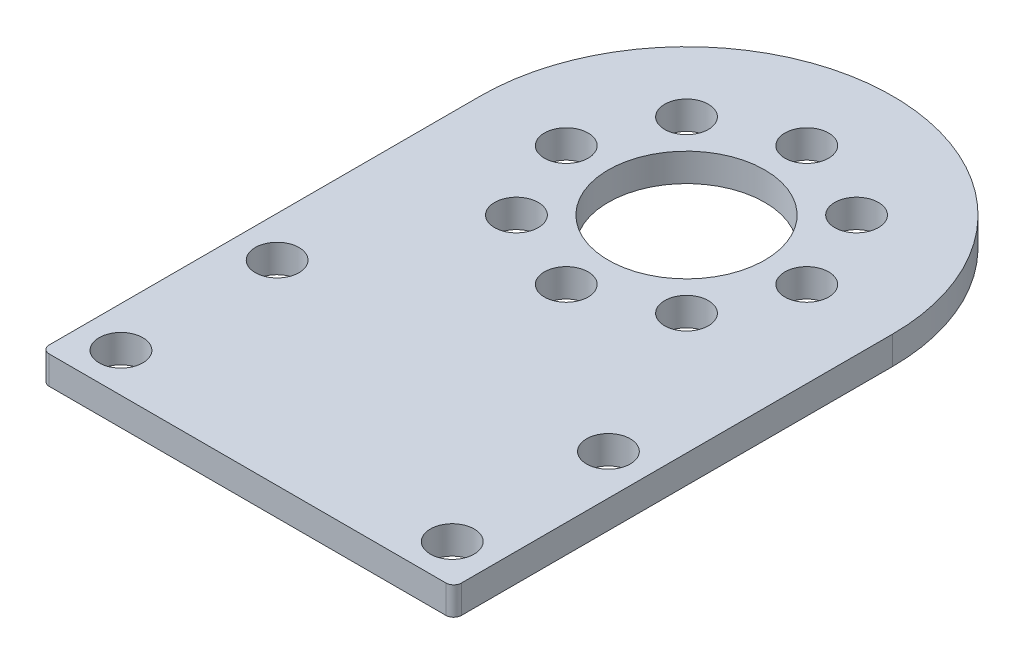
from build123d import *

# Parameters (mm, degrees)
SKETCH1_R           = 6.3627
SKETCH1_R_2         = 1.778
BOSS_EXTRUDE1_DEPTH = 2.286
SKETCH2_R           = 1.778
CUT_EXTRUDE1_DEPTH  = 7.62


with BuildPart() as part:
    # Sketch1 → Boss-Extrude1 (new body)
    with BuildSketch(Plane(origin=(0, 2.286, 0), x_dir=(1, 0, 0), z_dir=(0, 1, 0))):
        with BuildLine():
            Line((16.764, -35.060382), (16.764, 0))
            ThreePointArc((16.764, 0), (0, 16.764), (-16.764, 0))
            Line((-16.764, 0), (-16.764, -35.060382))
            ThreePointArc((-16.764, -35.060382), (-16.578012806, -35.509394806), (-16.129, -35.695382))
            Line((-16.129, -35.695382), (16.129, -35.695382))
            ThreePointArc((16.129, -35.695382), (16.578012806, -35.509394806), (16.764, -35.060382))
        make_face()
        with Locations(Location((0, 0, 0), (0, 0, 90))):
            Circle(SKETCH1_R, mode=Mode.SUBTRACT)
        with Locations(Location((9.779, 0, 0), (0, 0, 90))):
            Circle(SKETCH1_R_2, mode=Mode.SUBTRACT)
        with Locations(Location((6.914797213, 6.914797213, 0), (0, 0, 90))):
            Circle(SKETCH1_R_2, mode=Mode.SUBTRACT)
        with Locations(Location((0, 9.779, 0), (0, 0, 90))):
            Circle(SKETCH1_R_2, mode=Mode.SUBTRACT)
        with Locations(Location((-6.914797213, 6.914797213, 0), (0, 0, 90))):
            Circle(SKETCH1_R_2, mode=Mode.SUBTRACT)
        with Locations(Location((-9.779, 0, 0), (0, 0, 90))):
            Circle(SKETCH1_R_2, mode=Mode.SUBTRACT)
        with Locations(Location((-6.914797213, -6.914797213, 0), (0, 0, 90))):
            Circle(SKETCH1_R_2, mode=Mode.SUBTRACT)
        with Locations(Location((0, -9.779, 0), (0, 0, 90))):
            Circle(SKETCH1_R_2, mode=Mode.SUBTRACT)
        with Locations(Location((6.914797213, -6.914797213, 0), (0, 0, 90))):
            Circle(SKETCH1_R_2, mode=Mode.SUBTRACT)
        with Locations(Location((13.470384182, -32.520382, 0), (0, 0, 90))):
            Circle(SKETCH1_R_2, mode=Mode.SUBTRACT)
        with Locations(Location((-13.470384182, -32.520382, 0), (0, 0, 90))):
            Circle(SKETCH1_R_2, mode=Mode.SUBTRACT)
    extrude(amount=-BOSS_EXTRUDE1_DEPTH)

    # Sketch2 → Cut-Extrude1 (cut)
    with BuildSketch(Plane(origin=(0, 2.286, 0), x_dir=(1, 0, 0), z_dir=(0, 1, 0))):
        with Locations(Location((13.470384182, -19.820382, 0), (0, 0, 270))):
            Circle(SKETCH2_R)
        with Locations(Location((-13.470384182, -19.820382, 0), (0, 0, 270))):
            Circle(SKETCH2_R)
    extrude(amount=-CUT_EXTRUDE1_DEPTH, mode=Mode.SUBTRACT)


solid = part.part
